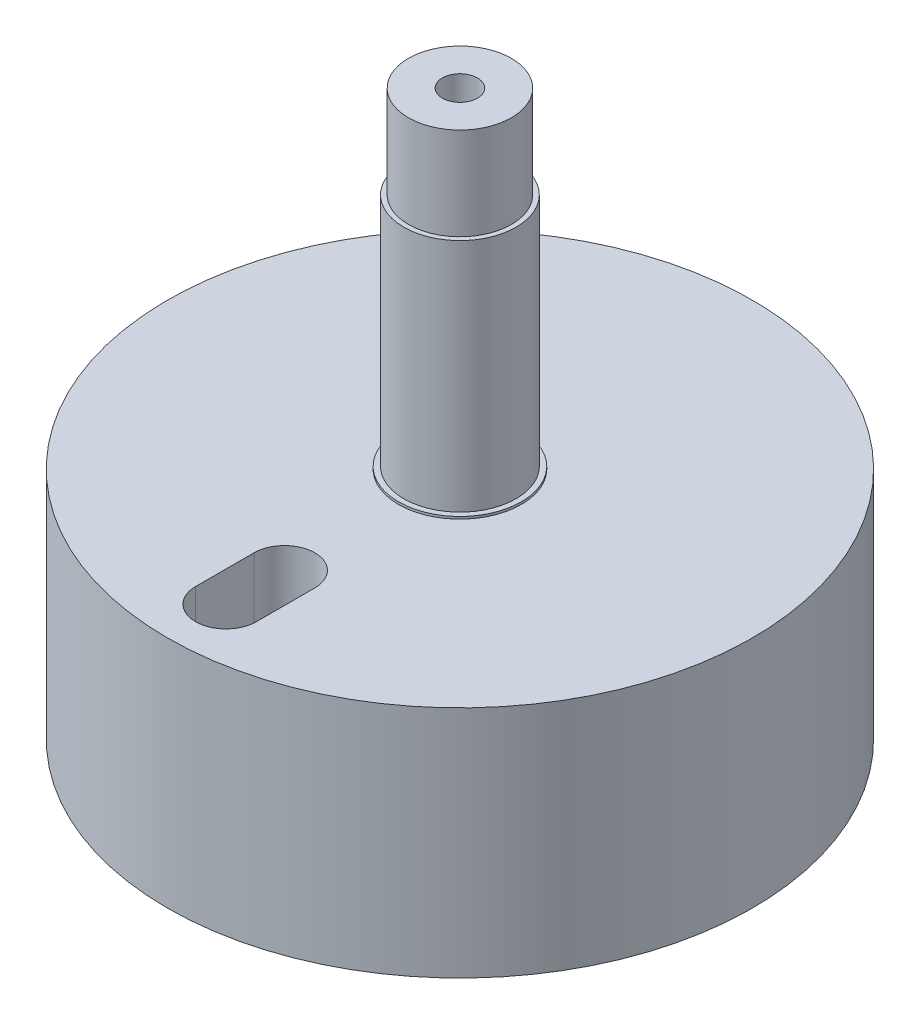
from build123d import *

# Parameters (mm, degrees)
SKETCH1_R           = 25
BOSS_EXTRUDE1_DEPTH = 20
CUT_EXTRUDE2_DEPTH  = 10
SKETCH5_R           = 1.5
CUT_EXTRUDE3_DEPTH  = 37.742346142
SKETCH2_R           = 5.25
BOSS_EXTRUDE2_DEPTH = 0.2
SKETCH7_R           = 4.8
BOSS_EXTRUDE3_DEPTH = 20.1
SKETCH8_R           = 4.4
BOSS_EXTRUDE4_DEPTH = 7.9
SKETCH6_R           = 1.5
CUT_EXTRUDE4_DEPTH  = 60.776584044


with BuildPart() as part:
    # Sketch1 → Boss-Extrude1 (new body)
    with BuildSketch(Plane(origin=(0, 0, 0), x_dir=(1, 0, 0), z_dir=(0, 1, 0))):
        with Locations(Location((0, 0, 0), (0, 0, 270))):
            Circle(SKETCH1_R)
    extrude(amount=BOSS_EXTRUDE1_DEPTH)

    # Sketch3 → Cut-Extrude2 (cut)
    with BuildSketch(Plane(origin=(0, 20, 0), x_dir=(1, 0, 0), z_dir=(0, 1, 0))):
        with BuildLine():
            Line((-2.6, -15), (-2.6, -20))
            ThreePointArc((-2.6, -20), (0, -22.6), (2.6, -20))
            Line((2.6, -20), (2.6, -15))
            ThreePointArc((2.6, -15), (0, -12.4), (-2.6, -15))
        make_face()
    extrude(amount=-CUT_EXTRUDE2_DEPTH, mode=Mode.SUBTRACT)

    # Sketch5 → Cut-Extrude3 (cut, through all)
    with BuildSketch(Plane(origin=(0, 10, 0), x_dir=(1, 0, 0), z_dir=(0, 1, 0))):
        with Locations(Location((0, -17.5, 0), (0, 0, 270))):
            Circle(SKETCH5_R)
    extrude(amount=-CUT_EXTRUDE3_DEPTH, mode=Mode.SUBTRACT)

    # Sketch2 → Boss-Extrude2 (add)
    with BuildSketch(Plane(origin=(0, 20, 0), x_dir=(1, 0, 0), z_dir=(0, 1, 0))):
        with Locations(Location((0, 0, 0), (0, 0, 270))):
            Circle(SKETCH2_R)
    extrude(amount=BOSS_EXTRUDE2_DEPTH)

    # Sketch7 → Boss-Extrude3 (add)
    with BuildSketch(Plane(origin=(0, 20.2, 0), x_dir=(1, 0, 0), z_dir=(0, 1, 0))):
        with Locations(Location((0, 0, 0), (0, 0, 270))):
            Circle(SKETCH7_R)
    extrude(amount=BOSS_EXTRUDE3_DEPTH)

    # Sketch8 → Boss-Extrude4 (add)
    with BuildSketch(Plane(origin=(0, 40.3, 0), x_dir=(1, 0, 0), z_dir=(0, 1, 0))):
        with Locations(Location((0, 0, 0), (0, 0, 270))):
            Circle(SKETCH8_R)
    extrude(amount=BOSS_EXTRUDE4_DEPTH)

    # Sketch6 → Cut-Extrude4 (cut, through all)
    with BuildSketch(Plane.XZ):
        with Locations(Location((0, 0, 0), (0, 0, 270))):
            Circle(SKETCH6_R)
    extrude(amount=-CUT_EXTRUDE4_DEPTH, mode=Mode.SUBTRACT)


solid = part.part
